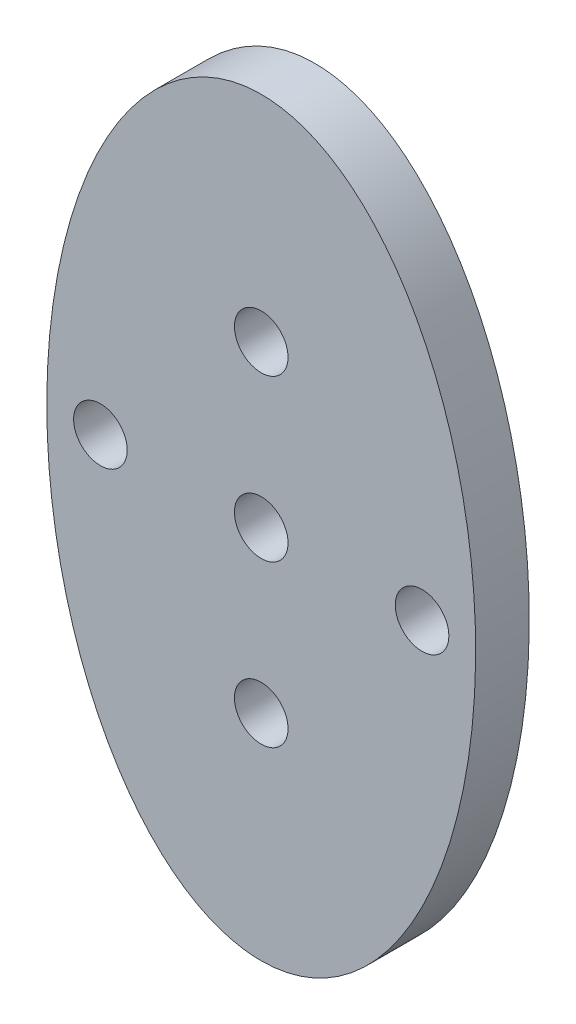
from build123d import *

# Parameters (mm, degrees)
MODEL_RX                = 21
MODEL_RY                = 11.999999999
MODEL_R                 = 1.5
SALIENTE_EXTRUIR1_DEPTH = 3


with BuildPart() as part:
    # Model → Saliente-Extruir1 (new body)
    with BuildSketch(Plane.XY):
        with Locations(Location((299.518754002, 285.878815596), (0, 0, -90))):
            Ellipse(MODEL_RX, MODEL_RY)
        with Locations((299.518754002, 276.878815596)):
            Circle(MODEL_R, mode=Mode.SUBTRACT)
        with Locations((299.518754002, 294.878815596)):
            Circle(MODEL_R, mode=Mode.SUBTRACT)
        with Locations((308.518754003, 285.878815596)):
            Circle(MODEL_R, mode=Mode.SUBTRACT)
        with Locations((290.518754002, 285.878815596)):
            Circle(MODEL_R, mode=Mode.SUBTRACT)
        with Locations((299.518754002, 285.878815596)):
            Circle(MODEL_R, mode=Mode.SUBTRACT)
    extrude(amount=SALIENTE_EXTRUIR1_DEPTH)


solid = part.part
